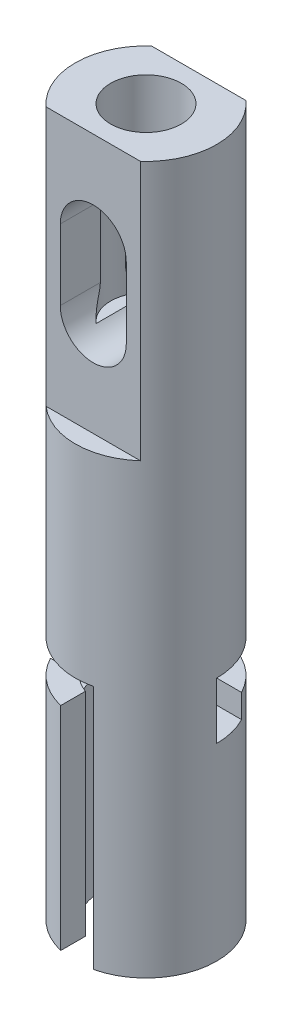
from build123d import *

# Parameters (mm, degrees)
SKETCH1_R                = 15
BOSS_EXTRUDE1_DEPTH      = 75
CUT_EXTRUDE1_DEPTH       = 52
CUT_EXTRUDE2_DEPTH       = 3.5
SKETCH9_R                = 10
CUT_EXTRUDE12_DEPTH      = 70
SKETCH17_W               = 7
SKETCH17_H               = 12
CUT_EXTRUDE19_DEPTH      = 15
SKETCH19_W               = 7
SKETCH19_H               = 12
CUT_EXTRUDE20_DEPTH      = 15
SKETCH20_R               = 7.5
CUT_EXTRUDE21_DEPTH      = 40
CUT_EXTRUDE25_DEPTH      = 152.492574075
CUT_EXTRUDE25_DEPTH_BACK = 55
SKETCH21_W               = 20
SKETCH21_H               = 7.639320226
CUT_EXTRUDE27_DEPTH      = 81.841883926
CUT_EXTRUDE27_DEPTH_BACK = 81.841883926


with BuildPart() as part:
    # Sketch1 → Boss-Extrude1 (new, symmetric)
    with BuildSketch(Plane(origin=(0, 0, 0), x_dir=(1, 0, 0), z_dir=(0, 1, 0))):
        with Locations(Location((0, 0, 0), (0, 0, 270))):
            Circle(SKETCH1_R)
    extrude(amount=BOSS_EXTRUDE1_DEPTH, both=True)

    # Sketch2 → Cut-Extrude1 (cut)
    with BuildSketch(Plane.XZ.offset(75)):
        with BuildLine():
            Line((3.5, 15), (3.5, -15))
            ThreePointArc((3.5, -15), (0, -18.5), (-3.5, -15))
            Line((-3.5, -15), (-3.5, 15))
            ThreePointArc((-3.5, 15), (0, 18.5), (3.5, 15))
        make_face()
    extrude(amount=-CUT_EXTRUDE1_DEPTH, mode=Mode.SUBTRACT)

    # Sketch3 → Cut-Extrude2 (cut, symmetric)
    with BuildSketch(Plane(origin=(0, -26.5, 0), x_dir=(1, 0, 0), z_dir=(0, 1, 0))):
        Polygon((-14.980069936, 0), (-15.328117643, -9.993941304), (-0.348047707, -16.993941304), (0, -7), align=None)
        Polygon((15, 0), (0, 7), (0.348047707, 16.993941304), (15.348047707, 9.993941304), align=None)
    extrude(amount=CUT_EXTRUDE2_DEPTH, both=True, mode=Mode.SUBTRACT)

    # Sketch9 → Cut-Extrude12 (cut)
    with BuildSketch(Plane.XZ.offset(75)):
        with Locations(Location((0, 0, 0), (0, 0, 270))):
            Circle(SKETCH9_R)
    extrude(amount=-CUT_EXTRUDE12_DEPTH, mode=Mode.SUBTRACT)

    # Sketch17 → Cut-Extrude19 (cut)
    with BuildSketch(Plane(origin=(15, 0, 0), x_dir=(0, 0, -1), z_dir=(1, 0, 0))):
        with Locations((3.5, -29)):
            Rectangle(SKETCH17_W, SKETCH17_H)
    extrude(amount=-CUT_EXTRUDE19_DEPTH, mode=Mode.SUBTRACT)

    # Sketch19 → Cut-Extrude20 (cut)
    with BuildSketch(Plane.ZY.offset(15)):
        with Locations((3.5, -29)):
            Rectangle(SKETCH19_W, SKETCH19_H)
    extrude(amount=-CUT_EXTRUDE20_DEPTH, mode=Mode.SUBTRACT)

    # Sketch20 → Cut-Extrude21 (cut)
    with BuildSketch(Plane(origin=(0, 75, 0), x_dir=(1, 0, 0), z_dir=(0, 1, 0))):
        with Locations(Location((0, 0, 0), (0, 0, 270))):
            Circle(SKETCH20_R)
    extrude(amount=-CUT_EXTRUDE21_DEPTH, mode=Mode.SUBTRACT)

    # Sketch21 → Cut-Extrude25 (cut, two sides: drawn at the far end of the back side and taken through both)
    with BuildSketch(Plane(origin=(0, 75, 0), x_dir=(1, 0, 0), z_dir=(0, 1, 0)).offset(-CUT_EXTRUDE25_DEPTH_BACK)):
        with Locations((0, 15)):
            Rectangle(SKETCH21_W, SKETCH21_H)
        with Locations((0, -15)):
            Rectangle(SKETCH21_W, SKETCH21_H)
    extrude(amount=CUT_EXTRUDE25_DEPTH + CUT_EXTRUDE25_DEPTH_BACK, mode=Mode.SUBTRACT)

    # Sketch23 → Cut-Extrude27 (cut, two sides: drawn at the far end of the back side and taken through both)
    with BuildSketch(Plane(origin=(0, 0, -11.180339887), x_dir=(-1, 0, 0), z_dir=(0, 0, -1)).offset(-CUT_EXTRUDE27_DEPTH_BACK)):
        with BuildLine():
            Line((7, 55), (7, 40))
            ThreePointArc((7, 40), (0, 33), (-7, 40))
            Line((-7, 40), (-7, 55))
            ThreePointArc((-7, 55), (0, 62), (7, 55))
        make_face()
    extrude(amount=CUT_EXTRUDE27_DEPTH + CUT_EXTRUDE27_DEPTH_BACK, mode=Mode.SUBTRACT)


solid = part.part
